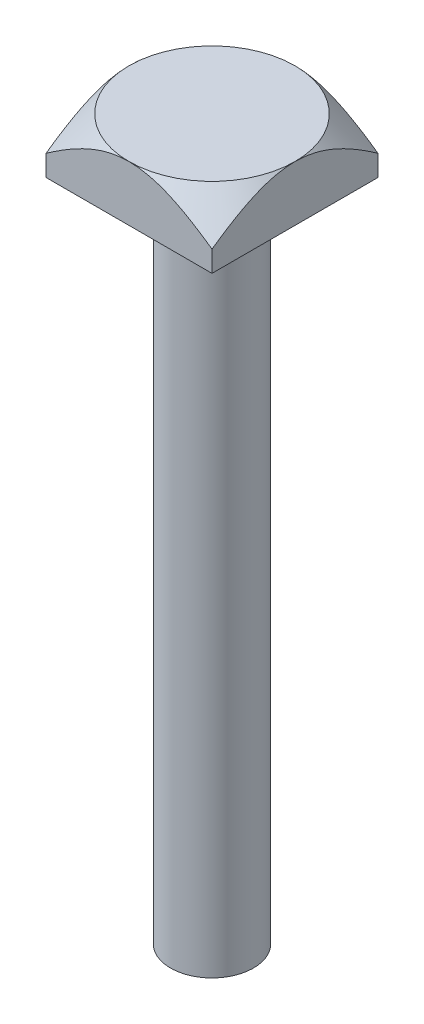
from build123d import *

# Parameters (mm, degrees)
SKETCH1_W           = 24
SKETCH1_H           = 24
BOSS_EXTRUDE1_DEPTH = 8
SKETCH2_OUTSIDE_W   = 72.498
SKETCH2_OUTSIDE_H   = 72.498
SKETCH2_OUTSIDE_R   = 12
CUT_EXTRUDE1_DEPTH  = 19.761663039
CUT_EXTRUDE1_DRAFT  = -45
SKETCH3_R           = 6
BOSS_EXTRUDE2_DEPTH = 96


with BuildPart() as part:
    # Sketch1 → Boss-Extrude1 (new body)
    with BuildSketch(Plane(origin=(0, 0, 0), x_dir=(1, 0, 0), z_dir=(0, 1, 0))):
        Rectangle(SKETCH1_W, SKETCH1_H)
    extrude(amount=BOSS_EXTRUDE1_DEPTH)


with BuildPart() as cut_extrude1_tool:
    # Sketch2 outside → Cut-Extrude1 (with draft: the straight prism first)
    with BuildSketch(Plane(origin=(0, 8, 0), x_dir=(1, 0, 0), z_dir=(0, 1, 0))):
        Rectangle(SKETCH2_OUTSIDE_W, SKETCH2_OUTSIDE_H)
        Circle(SKETCH2_OUTSIDE_R, mode=Mode.SUBTRACT)
    extrude(amount=-CUT_EXTRUDE1_DEPTH)
    # Cut-Extrude1: the draft: its side faces are tilted about the plane it starts from
    cut_extrude1_sides = [cut_extrude1_tool.faces().sort_by_distance(p)[0] for p in [
        (0, -1.88083152, 36.249),
        (36.249, -1.88083152, 0),
        (0, -1.88083152, -36.249),
        (-36.249, -1.88083152, 0),
        (-12, -1.88083152, 0),
    ]]
    draft(cut_extrude1_sides, Plane(origin=(0, 8, 0), x_dir=(1, 0, 0), z_dir=(0, 1, 0)), CUT_EXTRUDE1_DRAFT)


with BuildPart() as part_1:
    add(part.part)

    # Cut-Extrude1: cut by cut_extrude1_tool
    add(cut_extrude1_tool.part, mode=Mode.SUBTRACT)

    # Sketch3 → Boss-Extrude2 (add)
    with BuildSketch(Plane.XZ):
        with Locations(Location((0, 0, 0), (0, 0, 270))):
            Circle(SKETCH3_R)
    extrude(amount=BOSS_EXTRUDE2_DEPTH)


solid = part_1.part
